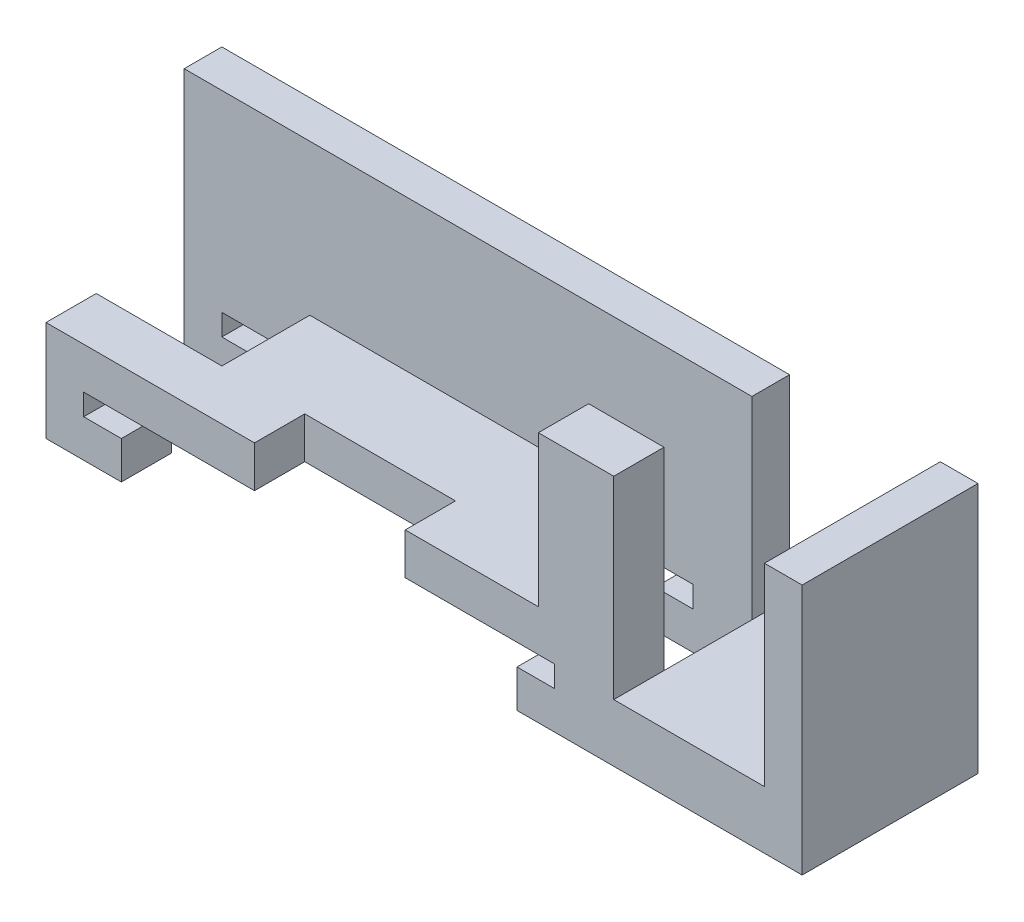
from build123d import *

# Parameters (mm, degrees)
CROQUIS1_W              = 60.2
CROQUIS1_H              = 14
SALIENTE_EXTRUIR1_DEPTH = 20
CROQUIS2_W              = 12
CROQUIS2_H              = 15.4
CORTAR_EXTRUIR1_DEPTH   = 14
CROQUIS3_W              = 10
CROQUIS3_H              = 7
CORTAR_EXTRUIR2_DEPTH   = 20
CORTAR_EXTRUIR3_DEPTH   = 12
CROQUIS5_W              = 12
CROQUIS5_H              = 4
CORTAR_EXTRUIR4_DEPTH   = 3.3


with BuildPart() as part:
    # Croquis1 → Saliente-Extruir1 (new body)
    with BuildSketch(Plane(origin=(0, 0, 0), x_dir=(1, 0, 0), z_dir=(0, 1, 0))):
        with Locations((-26.023666378, 13.176470588)):
            Rectangle(CROQUIS1_W, CROQUIS1_H)
    extrude(amount=SALIENTE_EXTRUIR1_DEPTH)

    # Croquis2 → Cortar-Extruir1 (cut)
    with BuildSketch(Plane.XY.offset(-6.176470588)):
        Polygon((-50.123666378, 0), (-18.623666378, 0), (-18.623666378, 3), (-15.623666378, 3), (-15.623666378, 4.7), (-20.023666378, 4.7), (-51.023666378, 4.7), (-53.123666378, 4.7), (-53.123666378, 3), (-50.123666378, 3), align=None)
        with Locations((-4.923666378, 12.3)):
            Rectangle(CROQUIS2_W, CROQUIS2_H)
    extrude(amount=-CORTAR_EXTRUIR1_DEPTH, mode=Mode.SUBTRACT)

    # Croquis3 → Cortar-Extruir2 (cut)
    with BuildSketch(Plane(origin=(0, 20, 0), x_dir=(1, 0, 0), z_dir=(0, 1, 0))):
        with Locations((-51.123666378, 13.676470588)):
            Rectangle(CROQUIS3_W, CROQUIS3_H)
        with Locations((-15.923666378, 13.676470588)):
            Rectangle(CROQUIS3_W, CROQUIS3_H)
    extrude(amount=-CORTAR_EXTRUIR2_DEPTH, mode=Mode.SUBTRACT)

    # Croquis4 → Cortar-Extruir3 (cut)
    with BuildSketch(Plane(origin=(0, 20, 0), x_dir=(1, 0, 0), z_dir=(0, 1, 0))):
        Polygon((-46.123666378, 17.176470588), (-20.923666378, 17.176470588), (-20.923666378, 10.176470588), (-16.923666378, 10.176470588), (-16.923666378, 6.176470588), (-56.123666378, 6.176470588), (-56.123666378, 10.176470588), (-46.123666378, 10.176470588), align=None)
    extrude(amount=-CORTAR_EXTRUIR3_DEPTH, mode=Mode.SUBTRACT)

    # Croquis5 → Cortar-Extruir4 (cut)
    with BuildSketch(Plane(origin=(0, 8, 0), x_dir=(1, 0, 0), z_dir=(0, 1, 0))):
        with Locations((-33.523666378, 8.176470588)):
            Rectangle(CROQUIS5_W, CROQUIS5_H)
    extrude(amount=-CORTAR_EXTRUIR4_DEPTH, mode=Mode.SUBTRACT)


solid = part.part
